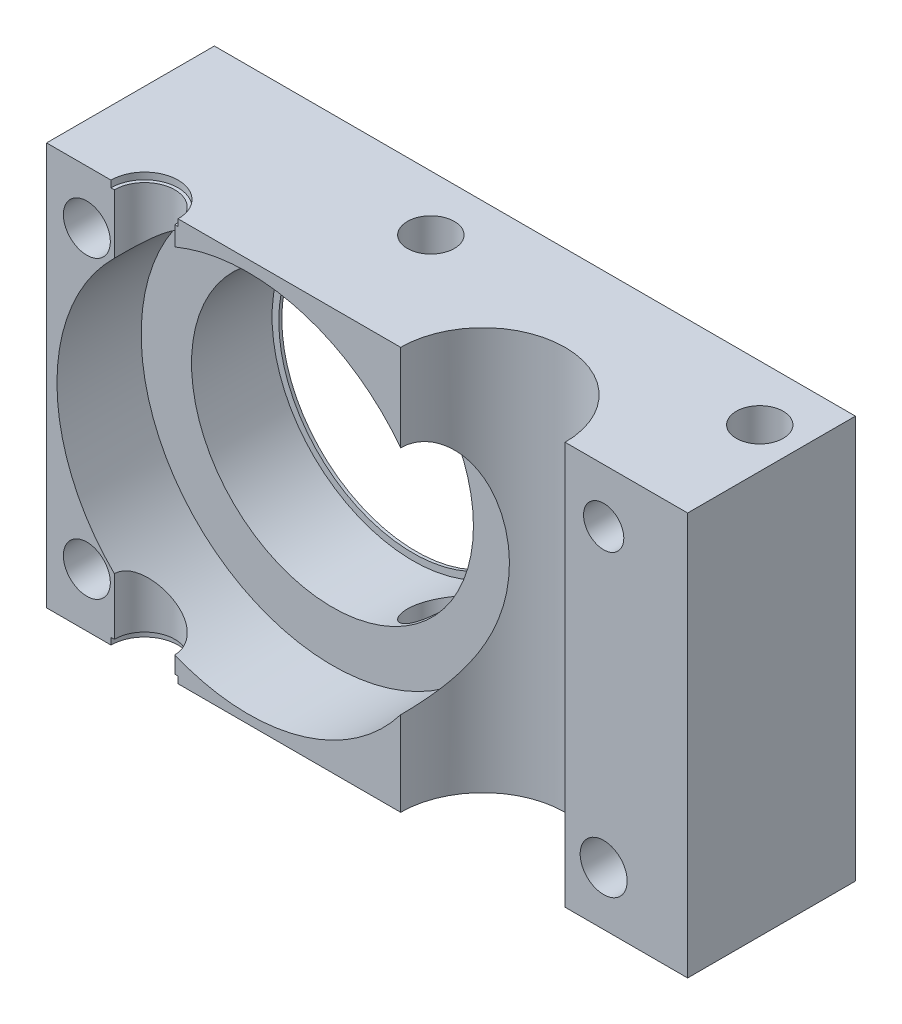
from build123d import *

# Parameters (mm, degrees)
BOSS_EXTRUDE1_DEPTH = 25
SKETCH3_R           = 3.5
SKETCH3_R_2         = 3
CUT_EXTRUDE1_DEPTH  = 30
SKETCH5_R           = 12.25
CUT_EXTRUDE3_DEPTH  = 299.5
SKETCH8_R           = 20
CUT_EXTRUDE6_DEPTH  = 299.5
SKETCH7_R           = 28.5
CUT_EXTRUDE5_DEPTH  = 12.55
SKETCH9_R           = 21
CUT_EXTRUDE7_DEPTH  = 12
SKETCH18_R          = 3.500000003
CUT_EXTRUDE11_DEPTH = 70
SKETCH25_R          = 4.5
CUT_EXTRUDE18_DEPTH = 15
CUT_EXTRUDE19_START = -15
SKETCH26_R          = 4.5
CUT_EXTRUDE19_DEPTH = 15
CUT_EXTRUDE22_DEPTH = 2
CUT_EXTRUDE23_START = -2
CUT_EXTRUDE23_DEPTH = 2


with BuildPart() as part:
    # Sketch2 → Boss-Extrude1 (new body)
    with BuildSketch(Plane.XY):
        Polygon((-180.451457822, 33.745151522), (-172.941457822, 33.745151522), (-172.941457822, 93.745151522), (-268.451457822, 93.745151522), (-268.451457822, 33.745151522), align=None)
    extrude(amount=BOSS_EXTRUDE1_DEPTH)

    # Sketch3 → Cut-Extrude1 (cut)
    with BuildSketch(Plane(origin=(-254.526795804, 25.613966889, 25), x_dir=(1, 0, 0), z_dir=(0, 0, 1))):
        with Locations((-7.924662018, 60.131184633)):
            Circle(SKETCH3_R)
        with Locations((69.075337951, 60.131184633)):
            Circle(SKETCH3_R_2)
        with Locations((69.075337951, 16.131184633)):
            Circle(SKETCH3_R)
        with Locations((-7.924662018, 16.131184633)):
            Circle(SKETCH3_R)
    extrude(amount=-CUT_EXTRUDE1_DEPTH, mode=Mode.SUBTRACT)

    # Sketch5 → Cut-Extrude3 (cut)
    with BuildSketch(Plane(origin=(-254.526795796, 218.819962105, 46.890114798), x_dir=(0, 0, 1), z_dir=(0, 1, 0))):
        with Locations((-21.890114798, 51.081437247)):
            Circle(SKETCH5_R)
    extrude(amount=-CUT_EXTRUDE3_DEPTH, mode=Mode.SUBTRACT)

    # Sketch8 → Cut-Extrude6 (cut)
    with BuildSketch(Plane(origin=(-254.526795804, 25.613966889, 25), x_dir=(1, 0, 0), z_dir=(0, 0, 1))):
        with Locations((16.121848571, 37.941765268)):
            Circle(SKETCH8_R)
    extrude(amount=-CUT_EXTRUDE6_DEPTH, mode=Mode.SUBTRACT)

    # Sketch7 → Cut-Extrude5 (cut)
    with BuildSketch(Plane(origin=(-254.526795804, 25.613966889, 25), x_dir=(1, 0, 0), z_dir=(0, 0, 1))):
        with Locations((16.121848571, 37.941765268)):
            Circle(SKETCH7_R)
    extrude(amount=-CUT_EXTRUDE5_DEPTH, mode=Mode.SUBTRACT)

    # Sketch9 → Cut-Extrude7 (cut)
    with BuildSketch(Plane.XY.offset(12.45)):
        with Locations((-238.404947233, 63.555732157)):
            Circle(SKETCH9_R)
    extrude(amount=-CUT_EXTRUDE7_DEPTH, mode=Mode.SUBTRACT)

    # Sketch18 → Cut-Extrude11 (cut)
    with BuildSketch(Plane(origin=(-155.753430747, 103.745151522, -13.013772077), x_dir=(0, 0, 1), z_dir=(0, 1, 0))):
        with Locations((21.263772077, -72.191927802)):
            Circle(SKETCH18_R)
        with Locations((21.263772077, -23.191927802)):
            Circle(SKETCH18_R)
    extrude(amount=-CUT_EXTRUDE11_DEPTH, mode=Mode.SUBTRACT)

    # Sketch25 → Cut-Extrude18 (cut)
    with BuildSketch(Plane(origin=(-254.526795796, 93.745151522, 46.890114798), x_dir=(0, 0, 1), z_dir=(0, 1, 0))):
        with Locations((-21.890114798, 0.672048442)):
            Circle(SKETCH25_R)
    extrude(amount=-CUT_EXTRUDE18_DEPTH, mode=Mode.SUBTRACT)

    # Sketch26 → Cut-Extrude19 (cut)
    with BuildSketch(Plane(origin=(-254.526795796, 33.745151522, 3.109885202), x_dir=(0, 0, -1), z_dir=(0, -1, 0)).offset(CUT_EXTRUDE19_START)):
        with Locations((-21.890114798, 0.672048442)):
            Circle(SKETCH26_R)
    extrude(amount=CUT_EXTRUDE19_DEPTH, mode=Mode.SUBTRACT)

    # Sketch29 → Cut-Extrude22 (cut)
    with BuildSketch(Plane(origin=(-217.163449612, 32.745151522, 13.13747962), x_dir=(-1, 0, 0), z_dir=(0, -1, 0))):
        with BuildLine():
            ThreePointArc((36.691297742, -16.86252038), (41.691297742, -11.86252038), (36.691297742, -6.86252038))
            ThreePointArc((36.691297742, -6.86252038), (31.691297742, -11.86252038), (36.691297742, -16.86252038))
        make_face()
    extrude(amount=-CUT_EXTRUDE22_DEPTH, mode=Mode.SUBTRACT)

    # Sketch30 → Cut-Extrude23 (cut)
    with BuildSketch(Plane(origin=(-217.163449612, 94.745151522, 36.86252038), x_dir=(-1, 0, 0), z_dir=(0, 1, 0)).offset(CUT_EXTRUDE23_START)):
        with BuildLine():
            ThreePointArc((36.691297742, -16.86252038), (41.691297742, -11.86252038), (36.691297742, -6.86252038))
            ThreePointArc((36.691297742, -6.86252038), (31.691297742, -11.86252038), (36.691297742, -16.86252038))
        make_face()
    extrude(amount=CUT_EXTRUDE23_DEPTH, mode=Mode.SUBTRACT)


solid = part.part
